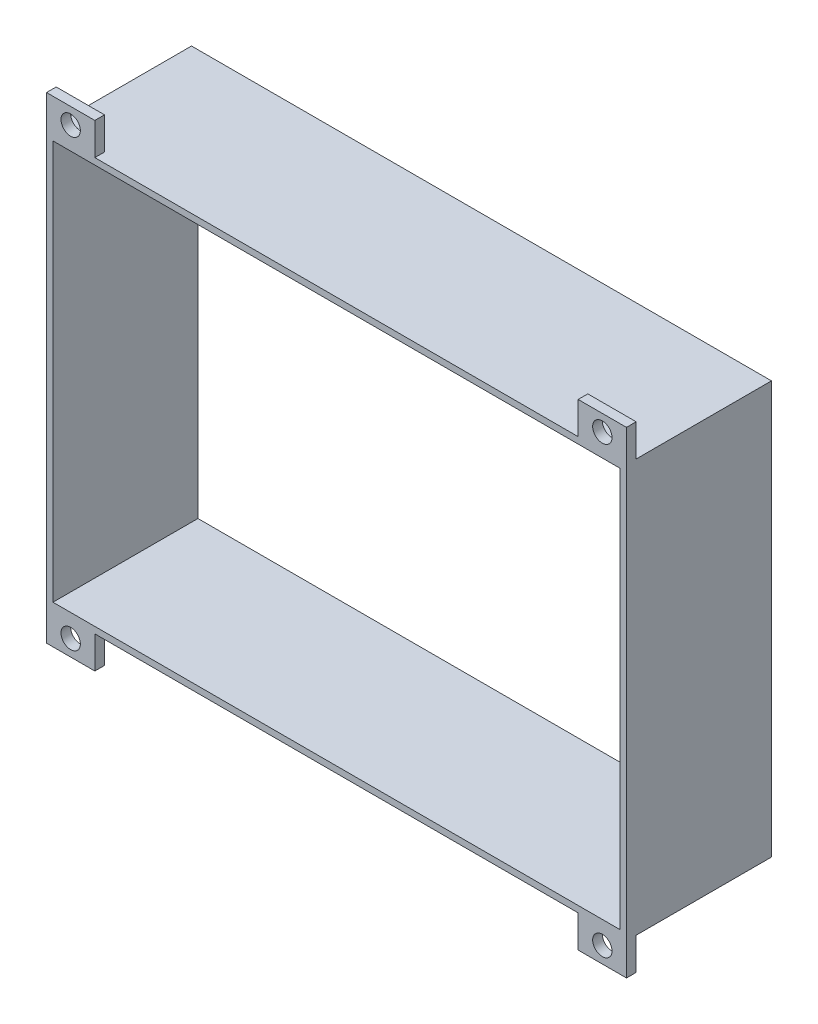
from build123d import *

# Parameters (mm, degrees)
SKETCH_1_W          = 180
SKETCH_1_H          = 128
SKETCH_1_W_2        = 176
SKETCH_1_H_2        = 124
EXTRUDE_1_DEPTH     = 45
SKETCH_2_W          = 15
SKETCH_2_H          = 3
EXTRUDE_2_DEPTH     = 10
SKETCH_3_R          = 3
CUT_EXTRUDE_1_DEPTH = 10


with BuildPart() as part:
    # 草圖1 → 填料-伸長1 (new body)
    with BuildSketch(Plane.XY):
        Rectangle(SKETCH_1_W, SKETCH_1_H)
        Rectangle(SKETCH_1_W_2, SKETCH_1_H_2, mode=Mode.SUBTRACT)
    extrude(amount=EXTRUDE_1_DEPTH)

    # 草圖2 → 填料-伸長2 (add)
    with BuildSketch(Plane.XZ.offset(64)):
        with Locations((82.5, 43.5)):
            Rectangle(SKETCH_2_W, SKETCH_2_H)
        with Locations((-82.5, 43.5)):
            Rectangle(SKETCH_2_W, SKETCH_2_H)
    extrude_2 = extrude(amount=EXTRUDE_2_DEPTH)

    # 草圖3 → 除料-伸長1 (cut)
    with BuildSketch(Plane(origin=(0, 0, 42), x_dir=(-1, 0, 0), z_dir=(0, 0, -1))):
        with Locations((-82.5, -69)):
            Circle(SKETCH_3_R)
        with Locations((82.5, -69)):
            Circle(SKETCH_3_R)
    cut_extrude_1 = extrude(amount=-CUT_EXTRUDE_1_DEPTH, mode=Mode.SUBTRACT)

    # 鏡射1: 填料-伸長2 across plane
    add(extrude_2.mirror(Plane.ZX))

    # 鏡射3: 除料-伸長1 across plane
    add(cut_extrude_1.mirror(Plane.ZX), mode=Mode.SUBTRACT)


solid = part.part
